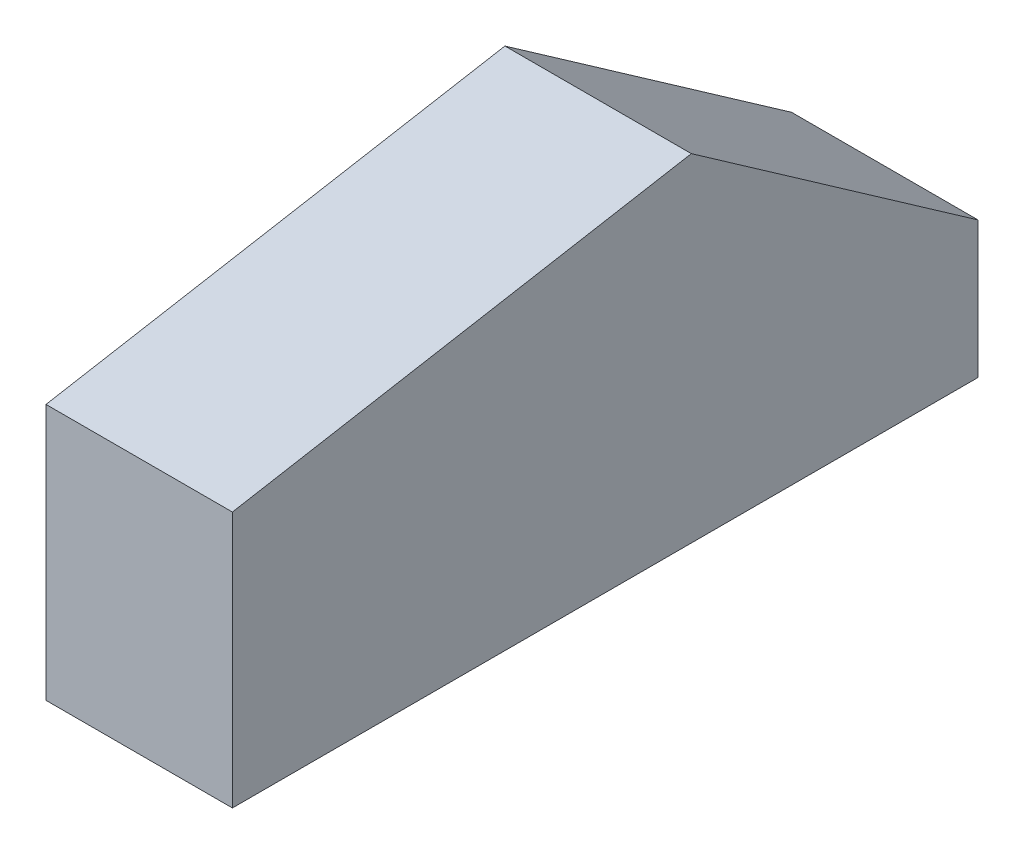
from build123d import *

# Parameters (mm, degrees)
BOSS_EXTRUDE1_DEPTH = 1


with BuildPart() as part:
    # Sketch2 → Boss-Extrude1 (new body)
    with BuildSketch(Plane(origin=(0, 0, 0), x_dir=(0, 0, -1), z_dir=(1, 0, 0))):
        Polygon((0, 0), (4, 0), (4, 0.732214822), (2.462019383, 1.809120444), (0, 1.375), align=None)
    extrude(amount=BOSS_EXTRUDE1_DEPTH)


solid = part.part
